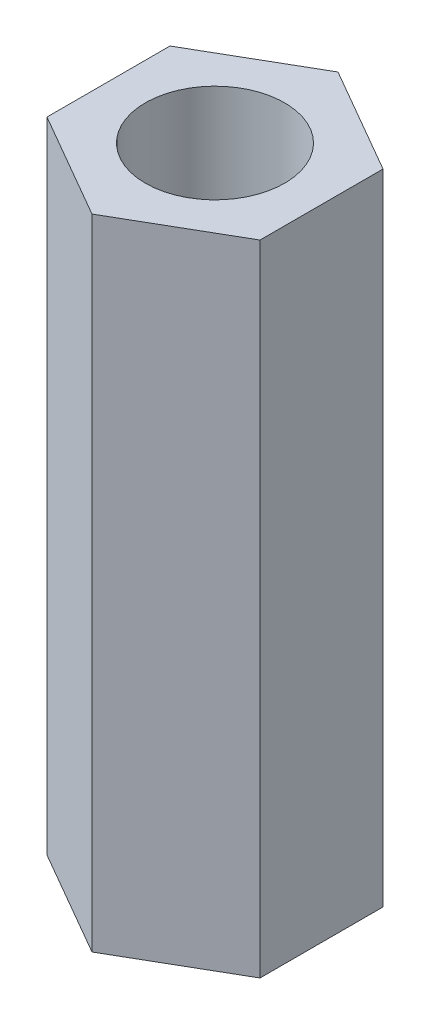
from build123d import *

# Parameters (mm, degrees)
SKETCH1_R           = 1.635
BOSS_EXTRUDE1_DEPTH = 15


with BuildPart() as part:
    # Sketch1 → Boss-Extrude1 (new body)
    with BuildSketch(Plane(origin=(0, 0, 0), x_dir=(1, 0, 0), z_dir=(0, 1, 0))):
        Polygon((2.500215268, 1.443500126), (2.500215413, -1.443499874), (1.45e-07, -2.887), (-2.500215268, -1.443500126), (-2.500215413, 1.443499874), (-1.45e-07, 2.887), align=None)
        with Locations(Location((0, 0, 0), (0, 0, 270))):
            Circle(SKETCH1_R, mode=Mode.SUBTRACT)
    extrude(amount=BOSS_EXTRUDE1_DEPTH)


solid = part.part
